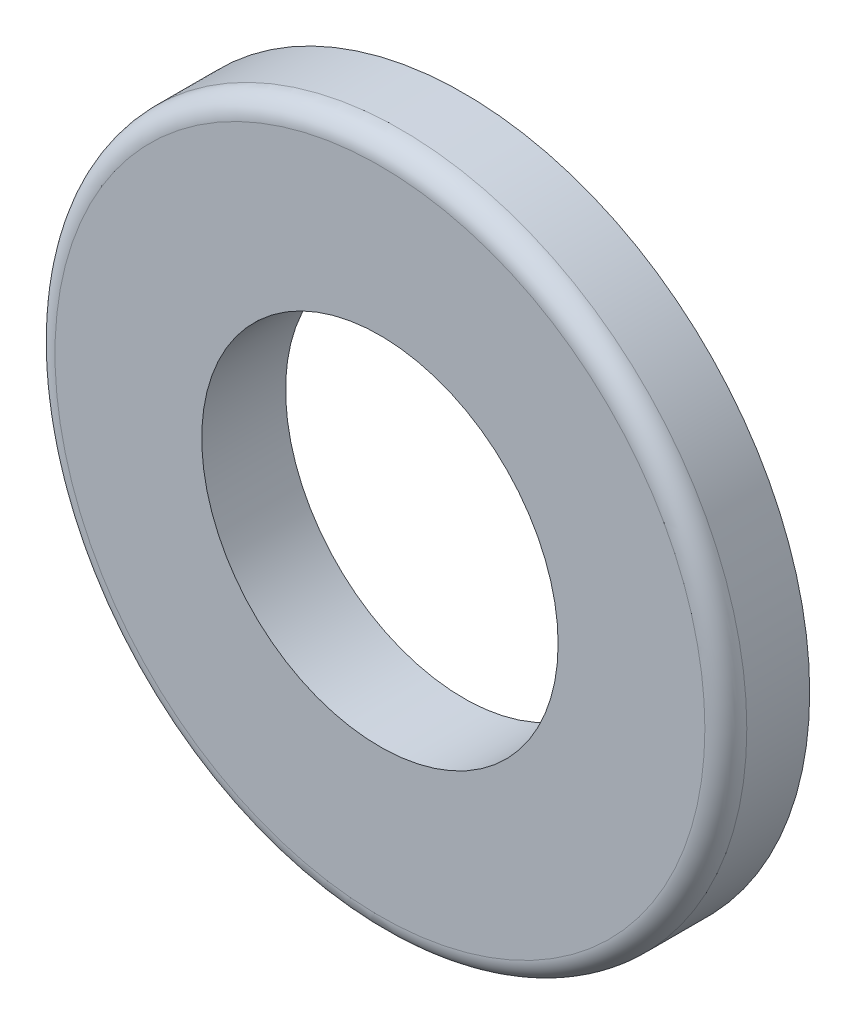
from build123d import *

# Parameters (mm, degrees)
SKETCH1_R           = 8.25
SKETCH1_R_2         = 4.25
BOSS_EXTRUDE1_DEPTH = 2
FILLET1_R           = 0.5


with BuildPart() as part:
    # Sketch1 → Boss-Extrude1 (new body)
    with BuildSketch(Plane.XY):
        Circle(SKETCH1_R)
        Circle(SKETCH1_R_2, mode=Mode.SUBTRACT)
    extrude(amount=BOSS_EXTRUDE1_DEPTH)

    # Fillet1
    fillet1_edges = [part.edges().sort_by_distance(p)[0] for p in [
        (-8.25, 0, 2),
    ]]
    fillet(fillet1_edges, radius=FILLET1_R)


solid = part.part
